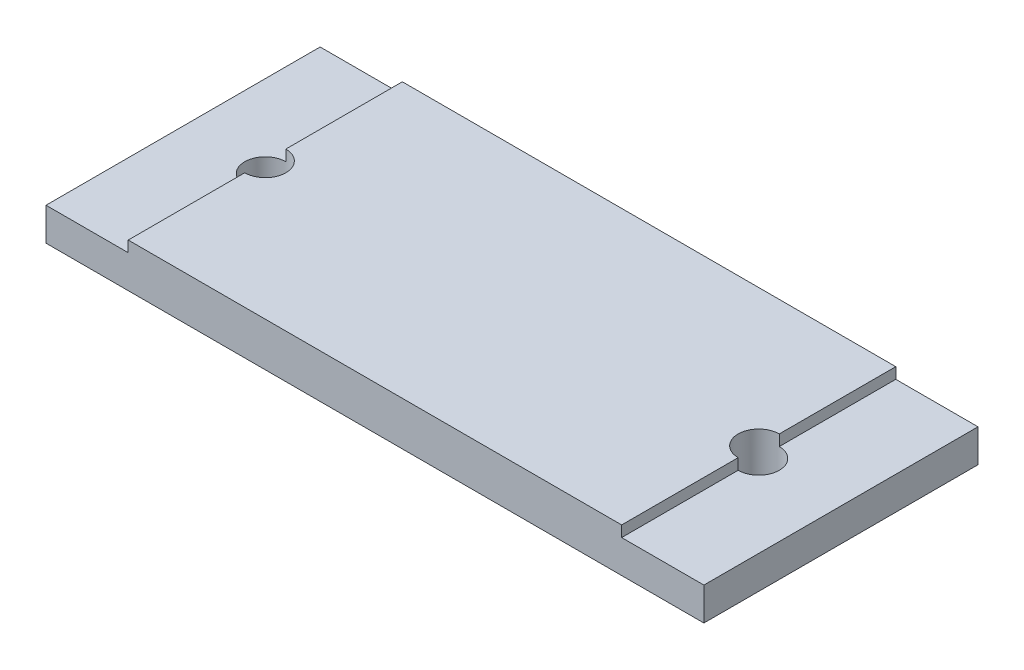
from build123d import *

# Parameters (mm, degrees)
SKETCH2_W           = 304.8
SKETCH2_H           = 127
SKETCH2_R           = 9.525
BOSS_EXTRUDE1_DEPTH = 15.24
BOSS_EXTRUDE2_DEPTH = 5.08


with BuildPart() as part:
    # Sketch2 → Boss-Extrude1 (new body)
    with BuildSketch(Plane(origin=(0, 0, 0), x_dir=(1, 0, 0), z_dir=(0, 1, 0))):
        with Locations((152.4, -63.5)):
            Rectangle(SKETCH2_W, SKETCH2_H)
        with Locations(Location((38.1, -63.5, 0), (0, 0, 90))):
            Circle(SKETCH2_R, mode=Mode.SUBTRACT)
        with Locations(Location((266.7, -63.5, 0), (0, 0, 90))):
            Circle(SKETCH2_R, mode=Mode.SUBTRACT)
    extrude(amount=BOSS_EXTRUDE1_DEPTH)

    # Sketch3 → Boss-Extrude2 (add)
    with BuildSketch(Plane(origin=(0, 15.24, 0), x_dir=(1, 0, 0), z_dir=(0, 1, 0))):
        with BuildLine():
            Line((38.1, 0), (266.7, 0))
            Line((266.7, 0), (266.7, -53.975))
            ThreePointArc((266.7, -53.975), (257.175, -63.5), (266.7, -73.025))
            Line((266.7, -73.025), (266.7, -127))
            Line((266.7, -127), (38.1, -127))
            Line((38.1, -127), (38.1, -73.025))
            ThreePointArc((38.1, -73.025), (47.625, -63.5), (38.1, -53.975))
            Line((38.1, -53.975), (38.1, 0))
        make_face()
    extrude(amount=BOSS_EXTRUDE2_DEPTH)


solid = part.part
